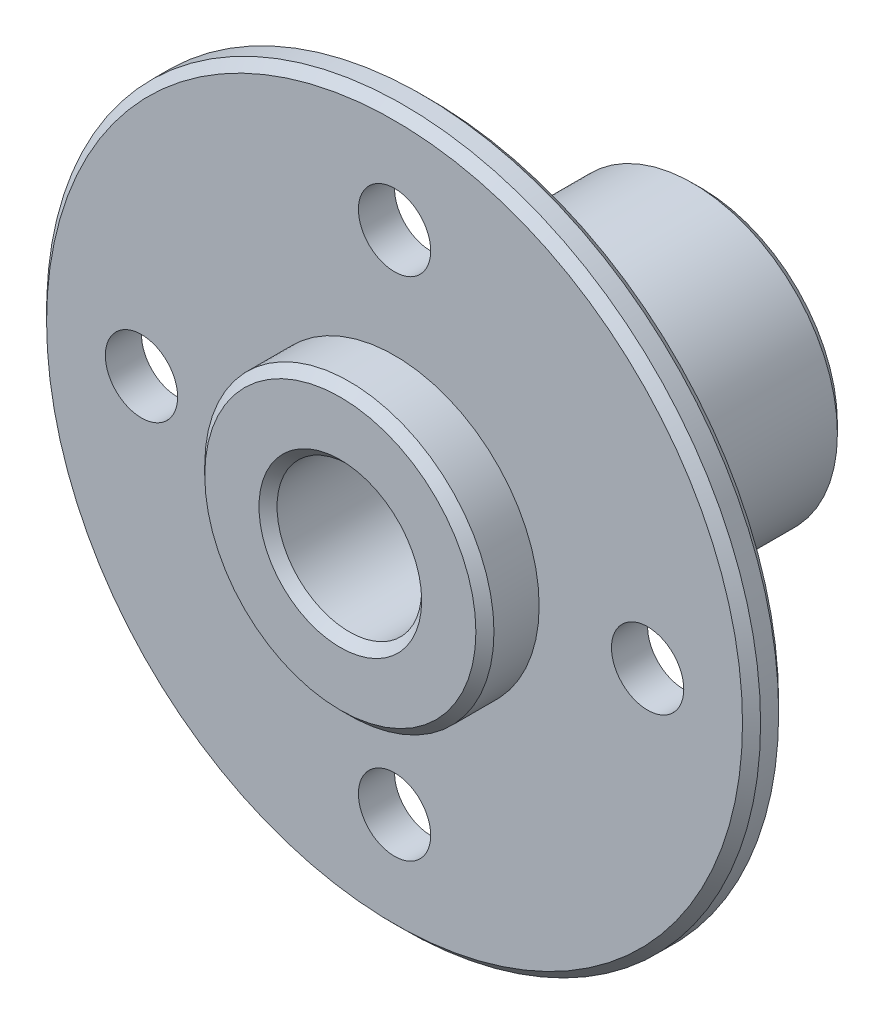
from build123d import *

# Parameters (mm, degrees)
SKETCH_1_R         = 19.75
EXTRUDE_1_DEPTH    = 2
SKETCH_2_R         = 8
EXTRUDE_2_DEPTH    = 3
EXTRUDE_START      = 15
SKETCH_3_R         = 8
EXTRUDE_3_DEPTH    = 15
HOLE_WIZARD_M8_1_D = 8
HOLE_WIZARD_M4_1_D = 4
CHAMFER_1_SIZE     = 0.5


with BuildPart() as part:
    # 草图1 → 凸台-拉伸1 (new body)
    with BuildSketch(Plane.XY):
        Circle(SKETCH_1_R)
    extrude(amount=EXTRUDE_1_DEPTH)

    # 草图2 → 凸台-拉伸2 (add)
    with BuildSketch(Plane.XY.offset(2)):
        Circle(SKETCH_2_R)
    extrude(amount=EXTRUDE_2_DEPTH)

    # 草图3 → 凸台-拉伸3 (add)
    with BuildSketch(Plane(origin=(0, 0, 0), x_dir=(-1, 0, 0), z_dir=(0, 0, -1)).offset(EXTRUDE_START)):
        with Locations(Location((0, 0, 0), (0, 0, 180))):
            Circle(SKETCH_3_R)
    extrude(amount=-EXTRUDE_3_DEPTH)

    # M8 螺纹孔1 (through all)
    with Locations(Plane.XY.offset(5)):
        with Locations((0, 0)):
            Hole(HOLE_WIZARD_M8_1_D / 2)

    # M4 螺纹孔1 (through all)
    with Locations(Plane.XY.offset(2)):
        with Locations((0, 14), (0, -14), (-14, 0), (14, 0)):
            Hole(HOLE_WIZARD_M4_1_D / 2)

    # 倒角1
    chamfer_1_edges = [part.edges().sort_by_distance(p)[0] for p in [
        (-8, 0, -15),
        (4, 0, 5),
        (4, 0, -15),
        (-19.75, 0, 0),
        (-19.75, 0, 2),
        (-8, 0, 5),
    ]]
    chamfer(chamfer_1_edges, length=CHAMFER_1_SIZE)


solid = part.part
